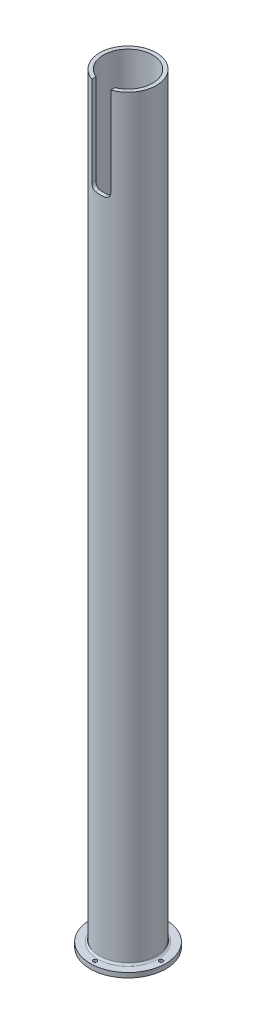
from build123d import *
from build123d.topology import SkipClean

# Parameters (mm, degrees)
SKETCH1_R           = 30
SKETCH1_R_2         = 26
BOSS_EXTRUDE1_DEPTH = 800
BOSS_EXTRUDE2_START = 5
SKETCH2_R           = 40
SKETCH2_R_2         = 26
SKETCH2_R_3         = 2
BOSS_EXTRUDE2_DEPTH = 5
FILLET1_R           = 2
SKETCH3_W           = 20
SKETCH3_H           = 53.092169015
CUT_EXTRUDE1_DEPTH  = 100
FILLET2_R           = 5


with BuildPart() as part:
    # Sketch1 → Boss-Extrude1 (new body)
    with BuildSketch(Plane(origin=(0, 0, 0), x_dir=(1, 0, 0), z_dir=(0, 1, 0))):
        with Locations(Location((0, 0, 0), (0, 0, 270))):
            Circle(SKETCH1_R)
        with Locations(Location((0, 0, 0), (0, 0, 270))):
            Circle(SKETCH1_R_2, mode=Mode.SUBTRACT)
    extrude(amount=BOSS_EXTRUDE1_DEPTH)

    # Sketch2 → Boss-Extrude2 (add)
    with SkipClean():  # the faces are left unmerged after this step: merging them gives an invalid solid
        with BuildSketch(Plane.XZ.offset(BOSS_EXTRUDE2_START)):
            with Locations(Location((0, 0, 0), (0, 0, 270))):
                Circle(SKETCH2_R)
            with Locations(Location((0, 0, 0), (0, 0, 270))):
                Circle(SKETCH2_R_2, mode=Mode.SUBTRACT)
            with Locations(Location((0, 35, 0), (0, 0, 270))):
                Circle(SKETCH2_R_3, mode=Mode.SUBTRACT)
            with Locations(Location((35, 0, 0), (0, 0, 270))):
                Circle(SKETCH2_R_3, mode=Mode.SUBTRACT)
            with Locations(Location((-35, 0, 0), (0, 0, 270))):
                Circle(SKETCH2_R_3, mode=Mode.SUBTRACT)
            with Locations(Location((0, -35, 0), (0, 0, 270))):
                Circle(SKETCH2_R_3, mode=Mode.SUBTRACT)
        extrude(amount=-BOSS_EXTRUDE2_DEPTH)

    # Fillet1
    fillet1_edges = [part.edges().sort_by_distance(p)[0] for p in [
        (0, 0, -30),
    ]]
    fillet(fillet1_edges, radius=FILLET1_R)

    # Sketch3 → Cut-Extrude1 (cut)
    with SkipClean():  # the faces are left unmerged after this step: merging them gives an invalid solid
        with BuildSketch(Plane(origin=(0, 800, 0), x_dir=(1, 0, 0), z_dir=(0, 1, 0))):
            with Locations((0, -32.696174879)):
                Rectangle(SKETCH3_W, SKETCH3_H)
        extrude(amount=-CUT_EXTRUDE1_DEPTH, mode=Mode.SUBTRACT)

    # Fillet2
    fillet2_edges = [part.edges().sort_by_distance(p)[0] for p in [
        (10, 700, 26.142135624),
        (-10, 700, 26.142135624),
    ]]
    fillet(fillet2_edges, radius=FILLET2_R)


solid = part.part
